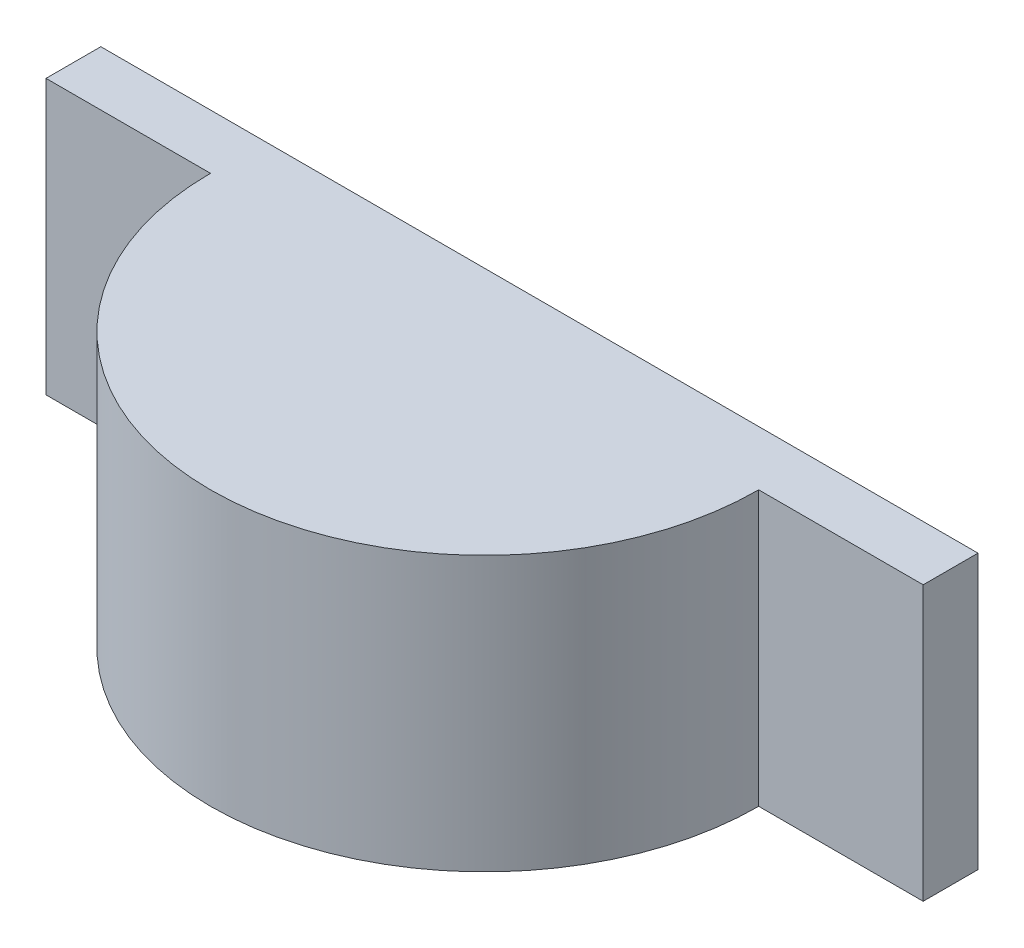
from build123d import *

# Parameters (mm, degrees)
CROQUIS1_W              = 160
CROQUIS1_H              = 50
SALIENTE_EXTRUIR1_DEPTH = 10
SALIENTE_EXTRUIR2_DEPTH = 50


with BuildPart() as part:
    # Croquis1 → Saliente-Extruir1 (new body)
    with BuildSketch(Plane.XY):
        with Locations((80, 25)):
            Rectangle(CROQUIS1_W, CROQUIS1_H)
    extrude(amount=SALIENTE_EXTRUIR1_DEPTH)

    # Croquis3 → Saliente-Extruir2 (add)
    with BuildSketch(Plane.XZ):
        with BuildLine():
            Line((30, 10), (130, 10))
            ThreePointArc((130, 10), (80, 60), (30, 10))
        make_face()
    extrude(amount=-SALIENTE_EXTRUIR2_DEPTH)


solid = part.part
